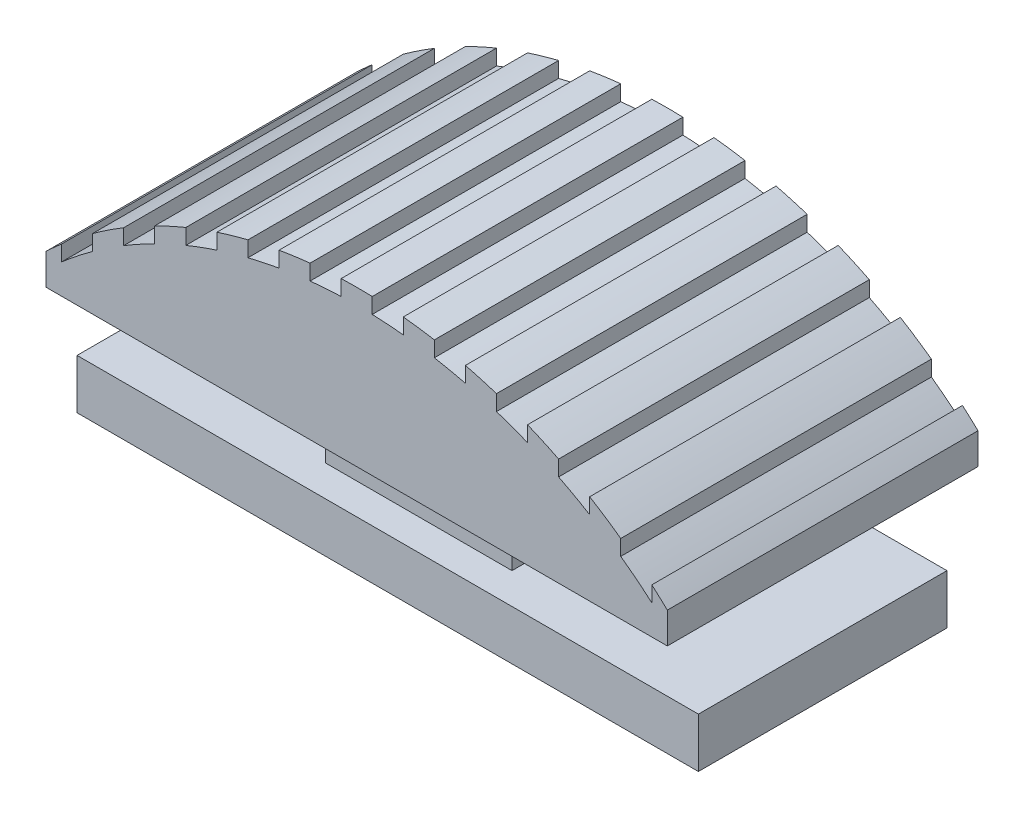
from build123d import *

# Parameters (mm, degrees)
SKETCH_1_W          = 10
SKETCH_1_H          = 5
EXTRUDE_1_DEPTH     = 0.5
SKETCH_2_W          = 3
SKETCH_2_H          = 3
EXTRUDE_2_DEPTH     = 0.5
SKETCH_3_W          = 10
SKETCH_3_H          = 5
EXTRUDE_3_DEPTH     = 0.5
EXTRUDE_4_DEPTH     = 5
CUT_EXTRUDE_3_DEPTH = 5
SKETCH_6_W          = 1.6
SKETCH_6_H          = 1.6
CUT_EXTRUDE_4_DEPTH = 2.5
SKETCH_7_W          = 10
SKETCH_7_H          = 0.5
CUT_EXTRUDE_5_DEPTH = 1
SKETCH_8_W          = 10
SKETCH_8_H          = 4
EXTRUDE_5_DEPTH     = 1
SKETCH_11_W         = 10
SKETCH_11_H         = 4
SKETCH_11_W_2       = 3
SKETCH_11_H_2       = 3
CUT_EXTRUDE_6_DEPTH = 0.7
CUT_EXTRUDE_7_REACH = 8.595
SKETCH_6_2_W        = 1.6
SKETCH_6_2_H        = 1.6


with BuildPart() as part:
    # 草图1 → 凸台-拉伸1 (new body)
    with BuildSketch(Plane(origin=(0, 0, 0), x_dir=(1, 0, 0), z_dir=(0, 1, 0))):
        Rectangle(SKETCH_1_W, SKETCH_1_H)
    extrude(amount=EXTRUDE_1_DEPTH)

    # 草图2 → 凸台-拉伸2 (add)
    with BuildSketch(Plane(origin=(0, 0.5, 0), x_dir=(1, 0, 0), z_dir=(0, 1, 0))):
        Rectangle(SKETCH_2_W, SKETCH_2_H)
    extrude(amount=EXTRUDE_2_DEPTH)

    # 草图3 → 凸台-拉伸3 (add)
    with BuildSketch(Plane(origin=(0, 1, 0), x_dir=(1, 0, 0), z_dir=(0, 1, 0))):
        Rectangle(SKETCH_3_W, SKETCH_3_H)
    extrude(amount=EXTRUDE_3_DEPTH)

    # 草图4 → 凸台-拉伸4 (add)
    with BuildSketch(Plane.XY.offset(2.5)):
        with BuildLine():
            Line((-5, 1.5), (5, 1.5))
            ThreePointArc((5, 1.5), (0, 3.5), (-5, 1.5))
        make_face()
    extrude(amount=-EXTRUDE_4_DEPTH)

    # 草图5 → 切除-拉伸3 (cut)
    with BuildSketch(Plane.XY.offset(2.5)):
        with BuildLine():
            Line((-4.75, 3.826153858), (-4.25, 3.826153858))
            Line((-4.25, 3.826153858), (-4.25, 1.873670062))
            ThreePointArc((-4.25, 1.873670062), (-4.504363668, 1.680951324), (-4.75, 1.477225575))
            Line((-4.75, 1.477225575), (-4.75, 3.826153858))
        make_face()
        with BuildLine():
            Line((-3.75, 3.826153858), (-3.75, 2.204836823))
            ThreePointArc((-3.75, 2.204836823), (-3.502717622, 2.347713704), (-3.25, 2.480740698))
            Line((-3.25, 2.480740698), (-3.25, 3.826153858))
            Line((-3.25, 3.826153858), (-3.75, 3.826153858))
        make_face()
        with BuildLine():
            Line((-2.75, 3.826153858), (-2.75, 2.708203932))
            ThreePointArc((-2.75, 2.708203932), (-2.501688927, 2.804708114), (-2.25, 2.892024376))
            Line((-2.25, 2.892024376), (-2.25, 3.826153858))
            Line((-2.25, 3.826153858), (-2.75, 3.826153858))
        make_face()
        with BuildLine():
            Line((-1.75, 3.826153858), (-1.75, 3.03562364))
            ThreePointArc((-1.75, 3.03562364), (-1.500932598, 3.092933197), (-1.25, 3.141428429))
            Line((-1.25, 3.141428429), (-1.25, 3.826153858))
            Line((-1.25, 3.826153858), (-1.75, 3.826153858))
        make_face()
        with BuildLine():
            Line((-0.75, 3.826153858), (-0.75, 3.211102551))
            ThreePointArc((-0.75, 3.211102551), (-0.500298955, 3.232717398), (-0.25, 3.245688373))
            Line((-0.25, 3.245688373), (-0.25, 3.826153858))
            Line((-0.25, 3.826153858), (-0.75, 3.826153858))
        make_face()
        with BuildLine():
            Line((0.25, 3.826153858), (0.25, 3.245688373))
            ThreePointArc((0.25, 3.245688373), (0.500298955, 3.232717398), (0.75, 3.211102551))
            Line((0.75, 3.211102551), (0.75, 3.826153858))
            Line((0.75, 3.826153858), (0.25, 3.826153858))
        make_face()
        with BuildLine():
            Line((1.25, 3.826153858), (1.25, 3.141428429))
            ThreePointArc((1.25, 3.141428429), (1.500932598, 3.092933197), (1.75, 3.03562364))
            Line((1.75, 3.03562364), (1.75, 3.826153858))
            Line((1.75, 3.826153858), (1.25, 3.826153858))
        make_face()
        with BuildLine():
            Line((2.25, 3.826153858), (2.25, 2.892024376))
            ThreePointArc((2.25, 2.892024376), (2.501688927, 2.804708114), (2.75, 2.708203932))
            Line((2.75, 2.708203932), (2.75, 3.826153858))
            Line((2.75, 3.826153858), (2.25, 3.826153858))
        make_face()
        with BuildLine():
            Line((3.25, 3.826153858), (3.25, 2.480740698))
            ThreePointArc((3.25, 2.480740698), (3.502717622, 2.347713704), (3.75, 2.204836823))
            Line((3.75, 2.204836823), (3.75, 3.826153858))
            Line((3.75, 3.826153858), (3.25, 3.826153858))
        make_face()
        with BuildLine():
            Line((4.25, 3.826153858), (4.25, 1.873670062))
            ThreePointArc((4.25, 1.873670062), (4.504363668, 1.680951324), (4.75, 1.477225575))
            Line((4.75, 1.477225575), (4.75, 3.826153858))
            Line((4.75, 3.826153858), (4.25, 3.826153858))
        make_face()
    extrude(amount=-CUT_EXTRUDE_3_DEPTH, mode=Mode.SUBTRACT)

    # 草图6 → 切除-拉伸4 (cut)
    with BuildSketch(Plane.XZ):
        Rectangle(SKETCH_6_W, SKETCH_6_H)
    extrude(amount=-CUT_EXTRUDE_4_DEPTH, mode=Mode.SUBTRACT)

    # 草图7 → 切除-拉伸5 (cut)
    with BuildSketch(Plane.XZ):
        with Locations((0, 2.25)):
            Rectangle(SKETCH_7_W, SKETCH_7_H)
        with Locations((0, -2.25)):
            Rectangle(SKETCH_7_W, SKETCH_7_H)
    extrude(amount=-CUT_EXTRUDE_5_DEPTH, mode=Mode.SUBTRACT)

    # 草图8 → 凸台-拉伸5 (add)
    with BuildSketch(Plane.XZ):
        Rectangle(SKETCH_8_W, SKETCH_8_H)
    extrude(amount=EXTRUDE_5_DEPTH)

    # 草图11 → 切除-拉伸6 (cut)
    with BuildSketch(Plane(origin=(0, 0.5, 0), x_dir=(1, 0, 0), z_dir=(0, 1, 0))):
        Rectangle(SKETCH_11_W, SKETCH_11_H)
        Rectangle(SKETCH_11_W_2, SKETCH_11_H_2, mode=Mode.SUBTRACT)
    extrude(amount=-CUT_EXTRUDE_6_DEPTH, mode=Mode.SUBTRACT)

    # 草图6<2> → 切除-拉伸7 (cut, up to next)
    with BuildSketch(Plane.XZ, mode=Mode.PRIVATE) as cut_extrude_7_sk1:
        Rectangle(SKETCH_6_2_W, SKETCH_6_2_H)
    cut_extrude_7_tool1 = extrude(cut_extrude_7_sk1.sketch, amount=CUT_EXTRUDE_7_REACH, mode=Mode.PRIVATE) & part.part
    add(cut_extrude_7_tool1.solids().sort_by_distance((0, 0, 0))[0], mode=Mode.SUBTRACT)


solid = part.part
